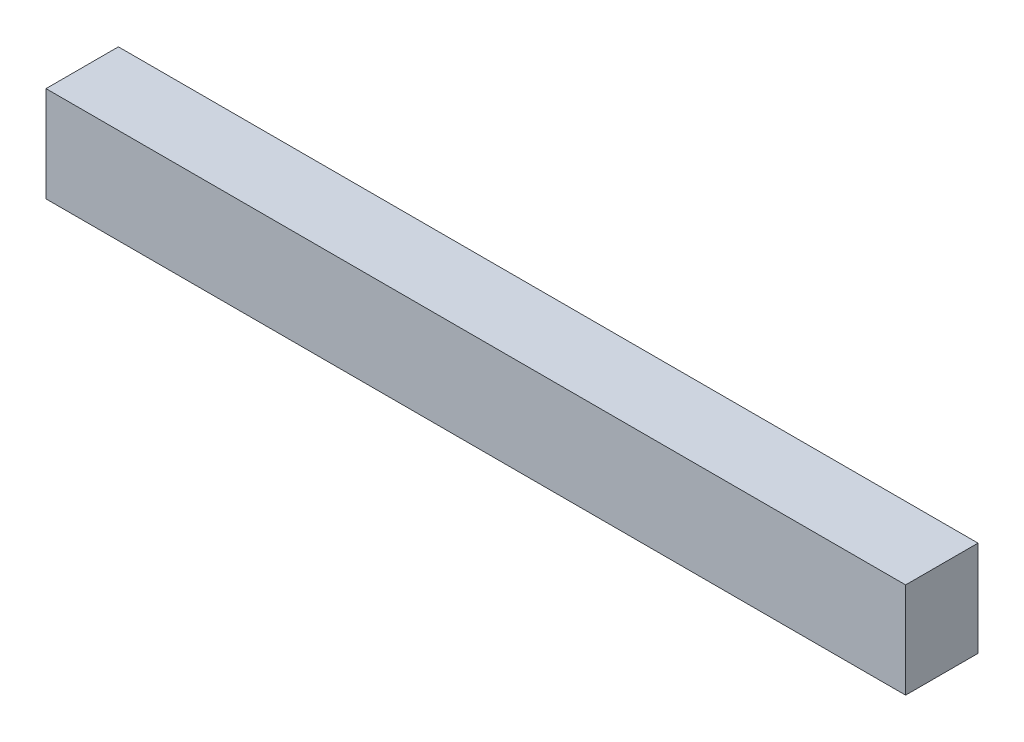
from build123d import *

# Parameters (mm, degrees)
SKETCH1_W           = 21.717
SKETCH1_H           = 2.413
BOSS_EXTRUDE1_DEPTH = 1.8288


with BuildPart() as part:
    # Sketch1 → Boss-Extrude1 (new body)
    with BuildSketch(Plane.XY):
        Rectangle(SKETCH1_W, SKETCH1_H)
    extrude(amount=BOSS_EXTRUDE1_DEPTH)


solid = part.part
